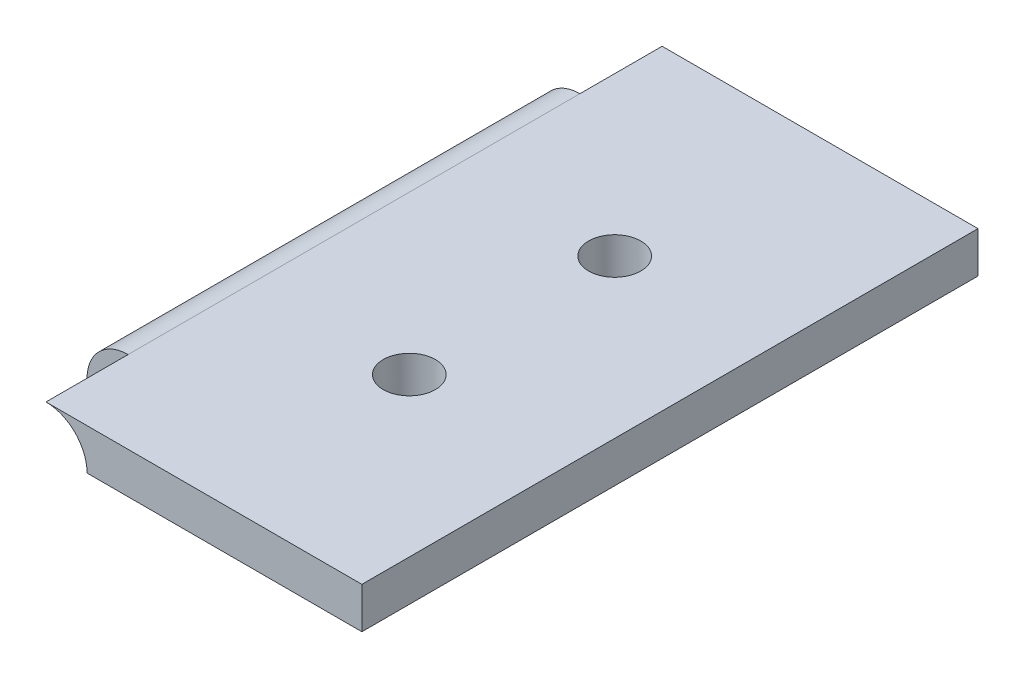
from build123d import *
from build123d.topology import SkipClean

# Parameters (mm, degrees)
SKETCH1_W           = 38.452994616
SKETCH1_H           = 5
BOSS_EXTRUDE1_DEPTH = 75
BOSS_EXTRUDE2_START = -10
BOSS_EXTRUDE2_DEPTH = 55
SKETCH5_R           = 3.175
CUT_EXTRUDE8_DEPTH  = 55
CUT_EXTRUDE9_DEPTH  = 75
CUT_EXTRUDE10_DEPTH = 10
CUT_EXTRUDE11_START = -65
CUT_EXTRUDE11_DEPTH = 10


with BuildPart() as part:
    # Sketch1 → Boss-Extrude1 (new body)
    with BuildSketch(Plane.XY):
        with Locations((25, -2.5)):
            Rectangle(SKETCH1_W, SKETCH1_H)
    extrude(amount=-BOSS_EXTRUDE1_DEPTH)

    # Sketch1<4> → Boss-Extrude2 (add)
    with BuildSketch(Plane.XY.offset(BOSS_EXTRUDE2_START)):
        with BuildLine():
            Line((5.773502692, -2.5), (5.773502692, 0))
            ThreePointArc((5.773502692, 0), (3.273502704, -0.669872974), (1.443375686, -2.499999977))
            ThreePointArc((1.443375686, -2.499999977), (4.479407453, -9.829629128), (10.773502692, -5))
            Line((10.773502692, -5), (8.273502692, -5))
            ThreePointArc((8.273502692, -5), (4.005735739, -6.767766953), (5.773502692, -2.5))
        make_face()
    extrude(amount=-BOSS_EXTRUDE2_DEPTH)

    # Sketch5 → Cut-Extrude8 (cut)
    with BuildSketch(Plane.XZ.offset(5)):
        with Locations((25, -25)):
            Circle(SKETCH5_R)
        with Locations((25, -50)):
            Circle(SKETCH5_R)
    extrude(amount=-CUT_EXTRUDE8_DEPTH, mode=Mode.SUBTRACT)

    # Sketch1<14> → Cut-Extrude9 (cut)
    with SkipClean():  # the faces are left unmerged after this step: merging them gives an invalid solid
        with BuildSketch(Plane.XY):
            with BuildLine():
                ThreePointArc((8.273502692, -5), (7.541269645, -3.232233047), (5.773502692, -2.5))
                Line((5.773502692, -2.5), (5.773502692, -5))
                Line((5.773502692, -5), (8.273502692, -5))
            make_face()
        extrude(amount=-CUT_EXTRUDE9_DEPTH, mode=Mode.SUBTRACT)

    # Sketch1<15> → Cut-Extrude10 (cut)
    with SkipClean():  # the faces are left unmerged after this step: merging them gives an invalid solid
        with BuildSketch(Plane.XY):
            with BuildLine():
                ThreePointArc((10.773502692, -5), (9.309036598, -1.464466094), (5.773502692, 0))
                Line((5.773502692, 0), (5.773502692, -2.5))
                ThreePointArc((5.773502692, -2.5), (7.541269645, -3.232233047), (8.273502692, -5))
                Line((8.273502692, -5), (10.773502692, -5))
            make_face()
        extrude(amount=-CUT_EXTRUDE10_DEPTH, mode=Mode.SUBTRACT)

    # Sketch1<16> → Cut-Extrude11 (cut)
    with BuildSketch(Plane.XY.offset(CUT_EXTRUDE11_START)):
        with BuildLine():
            ThreePointArc((10.773502692, -5), (9.309036598, -1.464466094), (5.773502692, 0))
            Line((5.773502692, 0), (5.773502692, -2.5))
            ThreePointArc((5.773502692, -2.5), (7.541269645, -3.232233047), (8.273502692, -5))
            Line((8.273502692, -5), (10.773502692, -5))
        make_face()
    extrude(amount=-CUT_EXTRUDE11_DEPTH, mode=Mode.SUBTRACT)


solid = part.part
